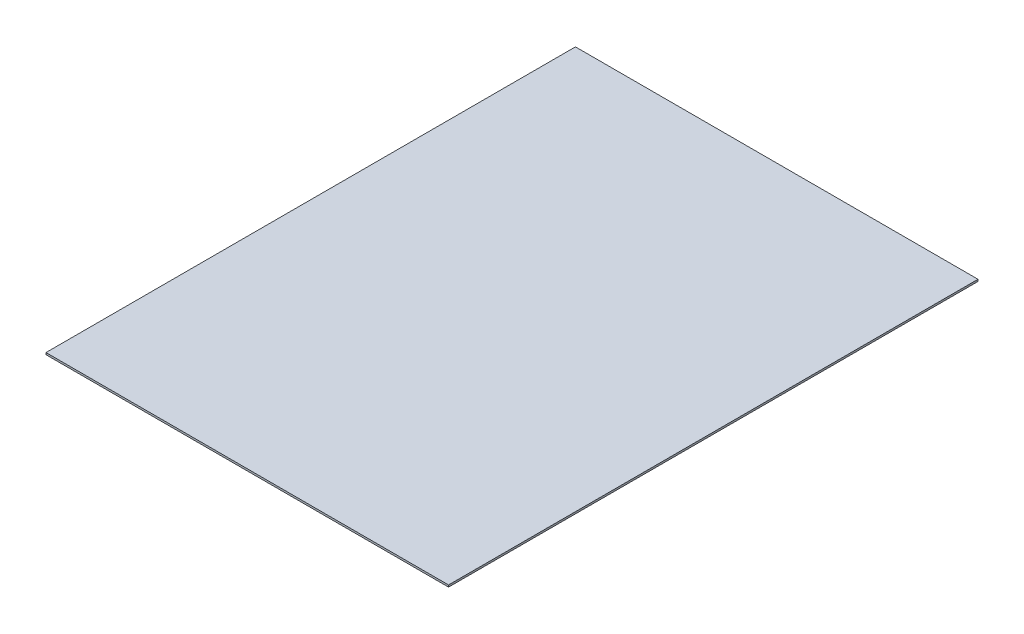
from build123d import *

# Parameters (mm, degrees)
SKETCH1_W           = 1475
SKETCH1_H           = 1940
BOSS_EXTRUDE1_DEPTH = 7


with BuildPart() as part:
    # Sketch1 → Boss-Extrude1 (new body)
    with BuildSketch(Plane(origin=(0, 0, 0), x_dir=(1, 0, 0), z_dir=(0, 1, 0))):
        Rectangle(SKETCH1_W, SKETCH1_H)
    extrude(amount=BOSS_EXTRUDE1_DEPTH)


solid = part.part
